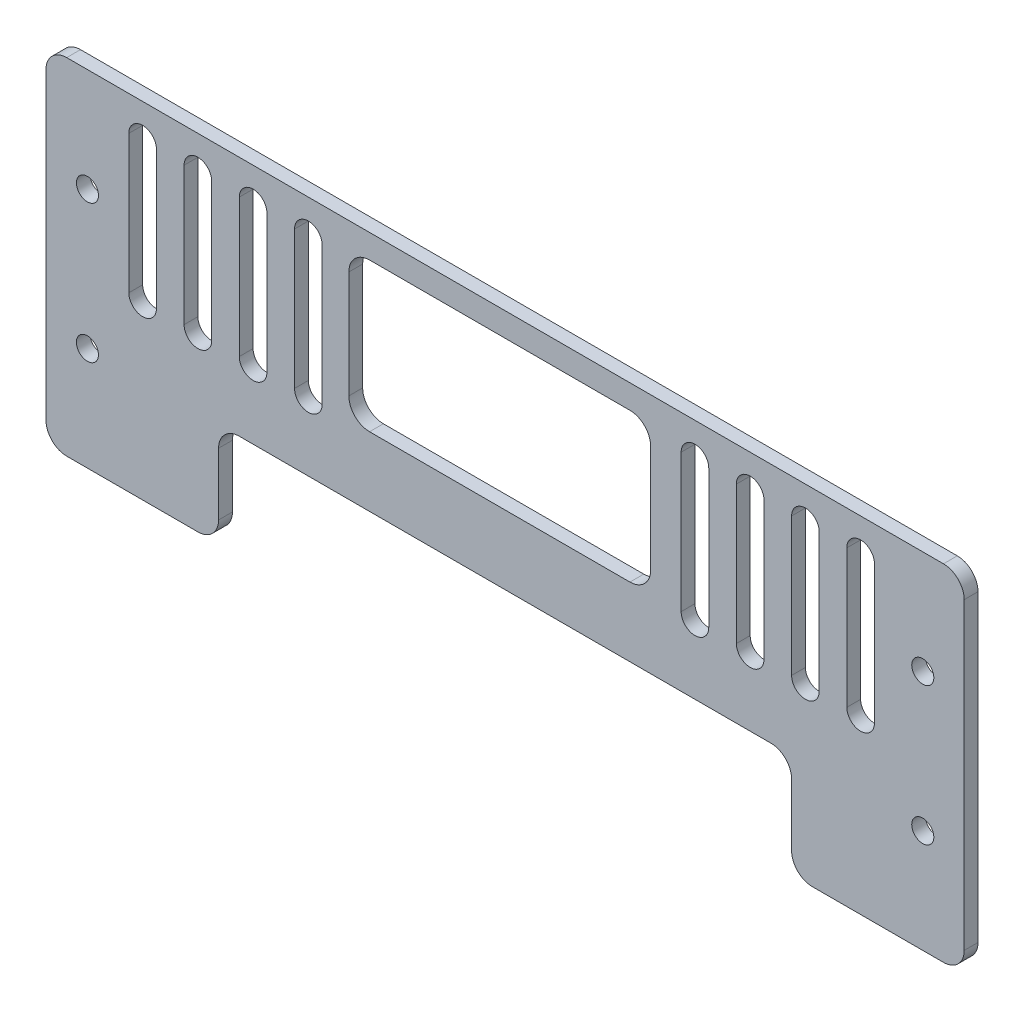
from build123d import *

# Parameters (mm, degrees)
SKETCH_1_W          = 133
SKETCH_1_H          = 50
EXTRUDE_1_DEPTH     = 2
FILLET_1_R          = 3
SKETCH_2_R          = 1.6
CUT_EXTRUDE_1_DEPTH = 3
SKETCH_3_W          = 43.714876359
SKETCH_3_H          = 21.542228592
CUT_EXTRUDE_2_DEPTH = 10
SKETCH_4_W          = 83
SKETCH_4_H          = 15
CUT_EXTRUDE_3_DEPTH = 10
FILLET_3_R          = 3
FILLET_4_R          = 3


with BuildPart() as part:
    # 草图1 → 凸台-拉伸1 (new body)
    with BuildSketch(Plane.XY):
        Rectangle(SKETCH_1_W, SKETCH_1_H)
    extrude(amount=EXTRUDE_1_DEPTH)

    # 圆角1
    fillet_1_edges = [part.edges().sort_by_distance(p)[0] for p in [
        (-66.5, 25, 1),
        (66.5, 25, 1),
        (66.5, -25, 1),
        (-66.5, -25, 1),
    ]]
    fillet(fillet_1_edges, radius=FILLET_1_R)

    # 草图2 → 切除-拉伸1 (cut)
    with BuildSketch(Plane.XY.offset(2)):
        with Locations((-60.5, 10)):
            Circle(SKETCH_2_R)
        with Locations((-60.5, -10)):
            Circle(SKETCH_2_R)
        with Locations((60.5, -10)):
            Circle(SKETCH_2_R)
        with Locations((60.5, 10)):
            Circle(SKETCH_2_R)
    extrude(amount=-CUT_EXTRUDE_1_DEPTH, mode=Mode.SUBTRACT)

    # 草图3 → 切除-拉伸2 (cut)
    with BuildSketch(Plane.XY.offset(2)):
        with BuildLine():
            Line((-50.5, 20), (-50.5, 0))
            ThreePointArc((-50.5, 0), (-52.5, -2), (-54.5, 0))
            Line((-54.5, 0), (-54.5, 20))
            ThreePointArc((-54.5, 20), (-52.5, 22), (-50.5, 20))
        make_face()
        with BuildLine():
            Line((-46.5, 20), (-46.5, 0))
            ThreePointArc((-46.5, 0), (-44.5, -2), (-42.5, 0))
            Line((-42.5, 0), (-42.5, 20))
            ThreePointArc((-42.5, 20), (-44.5, 22), (-46.5, 20))
        make_face()
        with BuildLine():
            Line((-38.5, 20), (-38.5, 0))
            ThreePointArc((-38.5, 0), (-36.5, -2), (-34.5, 0))
            Line((-34.5, 0), (-34.5, 20))
            ThreePointArc((-34.5, 20), (-36.5, 22), (-38.5, 20))
        make_face()
        with BuildLine():
            Line((-30.5, 20), (-30.5, 0))
            ThreePointArc((-30.5, 0), (-28.5, -2), (-26.5, 0))
            Line((-26.5, 0), (-26.5, 20))
            ThreePointArc((-26.5, 20), (-28.5, 22), (-30.5, 20))
        make_face()
        with Locations((-0.774062545, 10.771114296)):
            Rectangle(SKETCH_3_W, SKETCH_3_H)
        with BuildLine():
            Line((25.5, 20), (25.5, 0))
            ThreePointArc((25.5, 0), (27.5, -2), (29.5, 0))
            Line((29.5, 0), (29.5, 20))
            ThreePointArc((29.5, 20), (27.5, 22), (25.5, 20))
        make_face()
        with BuildLine():
            Line((33.5, 20), (33.5, 0))
            ThreePointArc((33.5, 0), (35.5, -2), (37.5, 0))
            Line((37.5, 0), (37.5, 20))
            ThreePointArc((37.5, 20), (35.5, 22), (33.5, 20))
        make_face()
        with BuildLine():
            Line((41.5, 20), (41.5, 0))
            ThreePointArc((41.5, 0), (43.5, -2), (45.5, 0))
            Line((45.5, 0), (45.5, 20))
            ThreePointArc((45.5, 20), (43.5, 22), (41.5, 20))
        make_face()
        with BuildLine():
            Line((49.5, 20), (49.5, 0))
            ThreePointArc((49.5, 0), (51.5, -2), (53.5, 0))
            Line((53.5, 0), (53.5, 20))
            ThreePointArc((53.5, 20), (51.5, 22), (49.5, 20))
        make_face()
    extrude(amount=-CUT_EXTRUDE_2_DEPTH, mode=Mode.SUBTRACT)

    # 草图4 → 切除-拉伸3 (cut)
    with BuildSketch(Plane.XY.offset(2)):
        with Locations((0, -17.5)):
            Rectangle(SKETCH_4_W, SKETCH_4_H)
    extrude(amount=-CUT_EXTRUDE_3_DEPTH, mode=Mode.SUBTRACT)

    # 圆角3
    fillet_3_edges = [part.edges().sort_by_distance(p)[0] for p in [
        (-41.5, -25, 1),
        (-41.5, -10, 1),
        (41.5, -10, 1),
        (41.5, -25, 1),
    ]]
    fillet(fillet_3_edges, radius=FILLET_3_R)

    # 圆角4
    fillet_4_edges = [part.edges().sort_by_distance(p)[0] for p in [
        (-22.631500725, 0, 1),
        (-22.631500725, 21.542228592, 1),
        (21.083375634, 21.542228592, 1),
        (21.083375634, 0, 1),
    ]]
    fillet(fillet_4_edges, radius=FILLET_4_R)


solid = part.part
